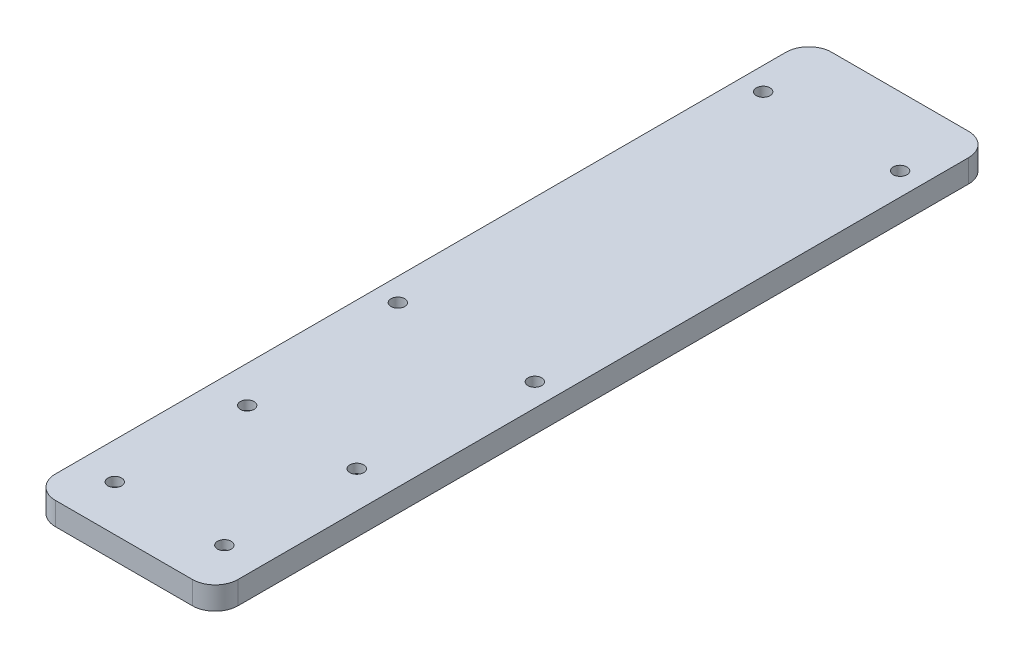
from build123d import *

# Parameters (mm, degrees)
SKETCH_1_W          = 40
SKETCH_1_H          = 170
SKETCH_1_R          = 1.5
EXTRUDE_1_DEPTH     = 5
FILLET_1_R          = 5
SKETCH_2_R          = 3
CUT_EXTRUDE_1_DEPTH = 3


with BuildPart() as part:
    # 草图1 → 凸台-拉伸1 (new body)
    with BuildSketch(Plane(origin=(0, 0, 0), x_dir=(1, 0, 0), z_dir=(0, 1, 0))):
        Rectangle(SKETCH_1_W, SKETCH_1_H)
        with Locations(Location((-15, 70, 0), (0, 0, 270))):
            Circle(SKETCH_1_R, mode=Mode.SUBTRACT)
        with Locations(Location((15, 70, 0), (0, 0, 270))):
            Circle(SKETCH_1_R, mode=Mode.SUBTRACT)
        with Locations(Location((15, -10, 0), (0, 0, 270))):
            Circle(SKETCH_1_R, mode=Mode.SUBTRACT)
        with Locations(Location((-15, -10, 0), (0, 0, 270))):
            Circle(SKETCH_1_R, mode=Mode.SUBTRACT)
        with Locations(Location((12, -46, 0), (0, 0, 270))):
            Circle(SKETCH_1_R, mode=Mode.SUBTRACT)
        with Locations(Location((-12, -46, 0), (0, 0, 270))):
            Circle(SKETCH_1_R, mode=Mode.SUBTRACT)
        with Locations(Location((-12, -75, 0), (0, 0, 270))):
            Circle(SKETCH_1_R, mode=Mode.SUBTRACT)
        with Locations(Location((12, -75, 0), (0, 0, 270))):
            Circle(SKETCH_1_R, mode=Mode.SUBTRACT)
    extrude(amount=EXTRUDE_1_DEPTH)

    # 圆角1
    fillet_1_edges = [part.edges().sort_by_distance(p)[0] for p in [
        (20, 2.5, 85),
        (-20, 2.5, 85),
        (-20, 2.5, -85),
        (20, 2.5, -85),
    ]]
    fillet(fillet_1_edges, radius=FILLET_1_R)

    # 草图2 → 切除-拉伸1 (cut)
    with BuildSketch(Plane.XZ):
        with Locations(Location((-12, 75, 0), (0, 0, 270))):
            Circle(SKETCH_2_R)
        with Locations(Location((12, 75, 0), (0, 0, 270))):
            Circle(SKETCH_2_R)
        with Locations(Location((12, 46, 0), (0, 0, 270))):
            Circle(SKETCH_2_R)
        with Locations(Location((-12, 46, 0), (0, 0, 270))):
            Circle(SKETCH_2_R)
    extrude(amount=-CUT_EXTRUDE_1_DEPTH, mode=Mode.SUBTRACT)


solid = part.part
